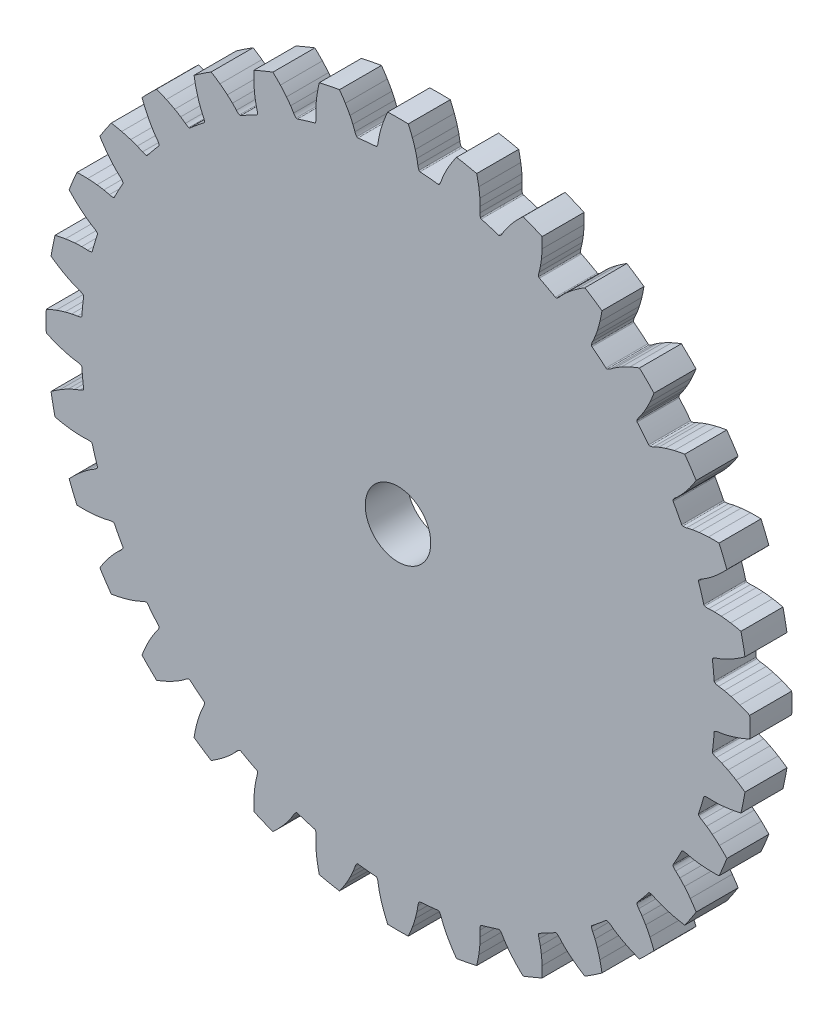
from build123d import *

# Parameters (mm, degrees)
BOSS_EXTRUDE1_DEPTH = 6.35
SKETCH2_R           = 4.953
CUT_EXTRUDE1_DEPTH  = 76.509747374


with BuildPart() as part:
    # Model → Boss-Extrude1 (new body)
    with BuildSketch(Plane.XY):
        with BuildLine():
            ThreePointArc((47.688684308, -4.696925442), (47.750668499, -4.0181311), (47.802991315, -3.338523772))
            ThreePointArc((47.802991315, -3.338523772), (47.836540789, -3.240219855), (47.914385854, -3.171449418))
            ThreePointArc((47.914385854, -3.171449418), (48.187811806, -3.062492558), (48.475756522, -3.001491007))
            ThreePointArc((48.475756522, -3.001491007), (48.904401032, -2.939153054), (49.330070734, -2.858981734))
            ThreePointArc((49.330070734, -2.858981734), (49.842301009, -2.742156063), (50.350208962, -2.60777748))
            ThreePointArc((50.350208962, -2.60777748), (51.029288231, -2.400648092), (51.699447533, -2.166260071))
            ThreePointArc((51.699447533, -2.166260071), (52.446034926, -1.872790357), (53.181655372, -1.552821976))
            ThreePointArc((53.181655372, -1.552821976), (53.204320541, 0), (53.181655372, 1.552821976))
            ThreePointArc((53.181655372, 1.552821976), (52.446034933, 1.872790354), (51.699447549, 2.166260065))
            ThreePointArc((51.699447549, 2.166260065), (51.029288253, 2.400648085), (50.350208991, 2.607777472))
            ThreePointArc((50.350208991, 2.607777472), (49.84230104, 2.742156056), (49.330070766, 2.858981727))
            ThreePointArc((49.330070766, 2.858981727), (48.904401064, 2.939153049), (48.475756554, 3.001491003))
            ThreePointArc((48.475756554, 3.001491003), (48.187811841, 3.062492546), (47.914385887, 3.171449391))
            ThreePointArc((47.914385887, 3.171449391), (47.836540814, 3.24021982), (47.802991318, 3.338523731))
            ThreePointArc((47.802991318, 3.338523731), (47.68868431, 4.696925421), (47.535783919, 6.051525995))
            ThreePointArc((47.535783919, 6.051525995), (47.549510606, 6.154486207), (47.612443453, 6.237122059))
            ThreePointArc((47.612443453, 6.237122059), (47.859359173, 6.397328101), (48.1298703, 6.513332751))
            ThreePointArc((48.1298703, 6.513332751), (48.538116994, 6.658097293), (48.939966924, 6.819772183))
            ThreePointArc((48.939966924, 6.819772183), (49.419563281, 7.034284251), (49.891495964, 7.265168713))
            ThreePointArc((49.891495964, 7.265168713), (50.517117975, 7.600799961), (51.12867352, 7.961425877))
            ThreePointArc((51.12867352, 7.961425877), (51.803662344, 8.394908626), (52.462725316, 8.852241335))
            ThreePointArc((52.462725316, 8.852241335), (52.182014441, 10.379648027), (51.856844238, 11.898211209))
            ThreePointArc((51.856844238, 11.898211209), (51.072935805, 12.068519056), (50.283440788, 12.210697855))
            ThreePointArc((50.283440788, 12.210697855), (49.58043158, 12.309840583), (48.873991697, 12.380508245))
            ThreePointArc((48.873991697, 12.380508245), (48.349627093, 12.413216856), (47.824447623, 12.427866586))
            ThreePointArc((47.824447623, 12.427866586), (47.391316396, 12.423453399), (46.958746639, 12.400969151))
            ThreePointArc((46.958746639, 12.400969151), (46.664433891, 12.404623339), (46.375005314, 12.458143852))
            ThreePointArc((46.375005314, 12.458143852), (46.285239567, 12.510406057), (46.233156574, 12.600275903))
            ThreePointArc((46.233156574, 12.600275903), (45.856034921, 13.910276095), (45.441803005, 15.209019012))
            ThreePointArc((45.441803005, 15.209019012), (45.435179397, 15.312678816), (45.480781552, 15.406004433))
            ThreePointArc((45.480781552, 15.406004433), (45.691698208, 15.611303028), (45.934380154, 15.777852784))
            ThreePointArc((45.934380154, 15.777852784), (46.306540342, 15.999480695), (46.669127631, 16.236446079))
            ThreePointArc((46.669127631, 16.236446079), (47.09765945, 16.540400966), (47.515480755, 16.858918547))
            ThreePointArc((47.515480755, 16.858918547), (48.063603207, 17.310153534), (48.593053257, 17.783158692))
            ThreePointArc((48.593053257, 17.783158692), (49.170504071, 18.339995979), (49.727682147, 18.917117976))
            ThreePointArc((49.727682147, 18.917117976), (49.154382789, 20.360412001), (48.53920366, 21.786358858))
            ThreePointArc((48.53920366, 21.786358858), (47.737132396, 21.800461339), (46.935069596, 21.785885375))
            ThreePointArc((46.935069596, 21.785885375), (46.226226726, 21.74597281), (45.51957431, 21.677463029))
            ThreePointArc((45.51957431, 21.677463029), (44.998904092, 21.607244694), (44.480957778, 21.519155501))
            ThreePointArc((44.480957778, 21.519155501), (44.057010016, 21.430327401), (43.637138424, 21.323885009))
            ThreePointArc((43.637138424, 21.323885009), (43.347767917, 21.270051415), (43.053459295, 21.266078831))
            ThreePointArc((43.053459295, 21.266078831), (42.955222521, 21.299824404), (42.886607551, 21.377806538))
            ThreePointArc((42.886607551, 21.377806538), (42.261163825, 22.589062659), (41.601519086, 23.782037958))
            ThreePointArc((41.601519086, 23.782037958), (41.574799724, 23.882413766), (41.601318722, 23.982842696))
            ThreePointArc((41.601318722, 23.982842696), (41.768130904, 24.225344334), (41.97365754, 24.436038783))
            ThreePointArc((41.97365754, 24.436038783), (42.295429313, 24.726013026), (42.604819936, 25.029162458))
            ThreePointArc((42.604819936, 25.029162458), (42.965818979, 25.410879347), (43.313472268, 25.804789596))
            ThreePointArc((43.313472268, 25.804789596), (43.763031121, 26.354287614), (44.190029209, 26.921494692))
            ThreePointArc((44.190029209, 26.921494692), (44.647750902, 27.580287572), (45.081632041, 28.255020382))
            ThreePointArc((45.081632041, 28.255020382), (44.237775773, 29.558736761), (43.356228707, 30.837268954))
            ThreePointArc((43.356228707, 30.837268954), (42.566817759, 30.694624119), (41.783010001, 30.523853538))
            ThreePointArc((41.783010001, 30.523853538), (41.095573903, 30.346419498), (40.415865211, 30.141365065))
            ThreePointArc((40.415865211, 30.141365065), (39.918898443, 29.970918235), (39.42808967, 29.783475339))
            ThreePointArc((39.42808967, 29.783475339), (39.029617448, 29.613645941), (38.638579452, 29.427335925))
            ThreePointArc((38.638579452, 29.427335925), (38.365271531, 29.318083343), (38.07739298, 29.256770328))
            ThreePointArc((38.07739298, 29.256770328), (37.974460363, 29.270702445), (37.891950251, 29.333800058))
            ThreePointArc((37.891950251, 29.333800058), (37.042219904, 30.399764214), (36.162512118, 31.441126522))
            ThreePointArc((36.162512118, 31.441126522), (36.116723813, 31.534360948), (36.123140543, 31.638033764))
            ThreePointArc((36.123140543, 31.638033764), (36.239437753, 31.908419244), (36.399910804, 32.155161515))
            ThreePointArc((36.399910804, 32.155161515), (36.658928655, 32.502338544), (36.903232904, 32.860022161))
            ThreePointArc((36.903232904, 32.860022161), (37.182826181, 33.304831886), (37.446951331, 33.758997052))
            ThreePointArc((37.446951331, 33.758997052), (37.780670292, 34.385641202), (38.08880712, 35.025252749))
            ThreePointArc((38.08880712, 35.025252749), (38.409209704, 35.760684181), (38.703120097, 36.5070982))
            ThreePointArc((38.703120097, 36.5070982), (37.621135843, 37.621135843), (36.5070982, 38.703120097))
            ThreePointArc((36.5070982, 38.703120097), (35.760684189, 38.409209707), (35.025252764, 38.088807127))
            ThreePointArc((35.025252764, 38.088807127), (34.385641222, 37.780670303), (33.758997077, 37.446951346))
            ThreePointArc((33.758997077, 37.446951346), (33.304831913, 37.182826197), (32.860022188, 36.903232922))
            ThreePointArc((32.860022188, 36.903232922), (32.50233857, 36.658928674), (32.155161541, 36.399910824))
            ThreePointArc((32.155161541, 36.399910824), (31.908419277, 36.239437769), (31.638033806, 36.123140547))
            ThreePointArc((31.638033806, 36.123140547), (31.53436099, 36.116723805), (31.441126553, 36.162512091))
            ThreePointArc((31.441126553, 36.162512091), (30.399764246, 37.042219878), (29.33380009, 37.891950226))
            ThreePointArc((29.33380009, 37.891950226), (29.27070246, 37.974460324), (29.256770332, 38.077392938))
            ThreePointArc((29.256770332, 38.077392938), (29.318083333, 38.365271496), (29.427335911, 38.638579423))
            ThreePointArc((29.427335911, 38.638579423), (29.613645927, 39.029617418), (29.783475326, 39.42808964))
            ThreePointArc((29.783475326, 39.42808964), (29.970918225, 39.918898413), (30.141365056, 40.415865183))
            ThreePointArc((30.141365056, 40.415865183), (30.346419492, 41.095573881), (30.523853534, 41.783009985))
            ThreePointArc((30.523853534, 41.783009985), (30.694624117, 42.566817751), (30.837268954, 43.356228707))
            ThreePointArc((30.837268954, 43.356228707), (29.558736761, 44.237775773), (28.255020382, 45.081632041))
            ThreePointArc((28.255020382, 45.081632041), (27.580287579, 44.647750906), (26.921494706, 44.190029219))
            ThreePointArc((26.921494706, 44.190029219), (26.354287633, 43.763031136), (25.804789618, 43.313472287))
            ThreePointArc((25.804789618, 43.313472287), (25.41087937, 42.965819), (25.029162482, 42.604819959))
            ThreePointArc((25.029162482, 42.604819959), (24.726013049, 42.295429337), (24.436038804, 41.973657564))
            ThreePointArc((24.436038804, 41.973657564), (24.225344363, 41.768130926), (23.982842736, 41.601318734))
            ThreePointArc((23.982842736, 41.601318734), (23.882413809, 41.574799725), (23.782037994, 41.601519065))
            ThreePointArc((23.782037994, 41.601519065), (22.589062696, 42.261163806), (21.377806575, 42.886607533))
            ThreePointArc((21.377806575, 42.886607533), (21.299824427, 42.955222485), (21.266078844, 43.053459254))
            ThreePointArc((21.266078844, 43.053459254), (21.270051412, 43.34776788), (21.323885001, 43.637138393))
            ThreePointArc((21.323885001, 43.637138393), (21.430327394, 44.057009984), (21.519155495, 44.480957745))
            ThreePointArc((21.519155495, 44.480957745), (21.607244689, 44.998904061), (21.677463025, 45.519574281))
            ThreePointArc((21.677463025, 45.519574281), (21.745972809, 46.226226703), (21.785885375, 46.935069579))
            ThreePointArc((21.785885375, 46.935069579), (21.800461339, 47.737132387), (21.786358858, 48.53920366))
            ThreePointArc((21.786358858, 48.53920366), (20.360412001, 49.154382789), (18.917117976, 49.727682147))
            ThreePointArc((18.917117976, 49.727682147), (18.339995985, 49.170504077), (17.783158704, 48.59305327))
            ThreePointArc((17.783158704, 48.59305327), (17.310153549, 48.063603224), (16.858918565, 47.515480778))
            ThreePointArc((16.858918565, 47.515480778), (16.540400984, 47.097659475), (16.236446098, 46.669127659))
            ThreePointArc((16.236446098, 46.669127659), (15.999480712, 46.30654037), (15.7778528, 45.934380183))
            ThreePointArc((15.7778528, 45.934380183), (15.611303052, 45.691698235), (15.40600447, 45.480781572))
            ThreePointArc((15.40600447, 45.480781572), (15.312678858, 45.435179406), (15.209019052, 45.441802992))
            ThreePointArc((15.209019052, 45.441802992), (13.910276134, 45.856034909), (12.600275943, 46.233156564))
            ThreePointArc((12.600275943, 46.233156564), (12.510406086, 46.285239536), (12.458143872, 46.375005277))
            ThreePointArc((12.458143872, 46.375005277), (12.404623344, 46.664433855), (12.400969149, 46.958746606))
            ThreePointArc((12.400969149, 46.958746606), (12.423453398, 47.391316363), (12.427866586, 47.82444759))
            ThreePointArc((12.427866586, 47.82444759), (12.413216857, 48.349627062), (12.380508247, 48.873991667))
            ThreePointArc((12.380508247, 48.873991667), (12.309840586, 49.580431557), (12.210697858, 50.283440771))
            ThreePointArc((12.210697858, 50.283440771), (12.068519058, 51.072935797), (11.898211209, 51.856844238))
            ThreePointArc((11.898211209, 51.856844238), (10.379648027, 52.182014441), (8.852241335, 52.462725316))
            ThreePointArc((8.852241335, 52.462725316), (8.394908631, 51.803662352), (7.961425885, 51.128673535))
            ThreePointArc((7.961425885, 51.128673535), (7.600799972, 50.517117996), (7.265168727, 49.89149599))
            ThreePointArc((7.265168727, 49.89149599), (7.034284264, 49.419563309), (6.819772196, 48.939966954))
            ThreePointArc((6.819772196, 48.939966954), (6.658097305, 48.538117025), (6.513332761, 48.129870331))
            ThreePointArc((6.513332761, 48.129870331), (6.397328119, 47.859359205), (6.237122092, 47.61244348))
            ThreePointArc((6.237122092, 47.61244348), (6.154486246, 47.549510624), (6.051526036, 47.535783914))
            ThreePointArc((6.051526036, 47.535783914), (4.696925462, 47.688684306), (3.338523772, 47.802991315))
            ThreePointArc((3.338523772, 47.802991315), (3.240219855, 47.836540789), (3.171449418, 47.914385854))
            ThreePointArc((3.171449418, 47.914385854), (3.062492558, 48.187811806), (3.001491007, 48.475756522))
            ThreePointArc((3.001491007, 48.475756522), (2.939153054, 48.904401032), (2.858981734, 49.330070734))
            ThreePointArc((2.858981734, 49.330070734), (2.742156063, 49.842301009), (2.60777748, 50.350208962))
            ThreePointArc((2.60777748, 50.350208962), (2.400648092, 51.029288231), (2.166260071, 51.699447533))
            ThreePointArc((2.166260071, 51.699447533), (1.872790357, 52.446034926), (1.552821976, 53.181655372))
            ThreePointArc((1.552821976, 53.181655372), (0, 53.204320541), (-1.552821976, 53.181655372))
            ThreePointArc((-1.552821976, 53.181655372), (-1.872790354, 52.446034933), (-2.166260065, 51.699447549))
            ThreePointArc((-2.166260065, 51.699447549), (-2.400648085, 51.029288253), (-2.607777472, 50.350208991))
            ThreePointArc((-2.607777472, 50.350208991), (-2.742156056, 49.84230104), (-2.858981727, 49.330070766))
            ThreePointArc((-2.858981727, 49.330070766), (-2.939153049, 48.904401064), (-3.001491003, 48.475756554))
            ThreePointArc((-3.001491003, 48.475756554), (-3.062492546, 48.187811841), (-3.171449391, 47.914385887))
            ThreePointArc((-3.171449391, 47.914385887), (-3.24021982, 47.836540814), (-3.338523731, 47.802991318))
            ThreePointArc((-3.338523731, 47.802991318), (-4.696925421, 47.68868431), (-6.051525995, 47.535783919))
            ThreePointArc((-6.051525995, 47.535783919), (-6.154486207, 47.549510606), (-6.237122059, 47.612443453))
            ThreePointArc((-6.237122059, 47.612443453), (-6.397328101, 47.859359173), (-6.513332751, 48.1298703))
            ThreePointArc((-6.513332751, 48.1298703), (-6.658097293, 48.538116994), (-6.819772183, 48.939966924))
            ThreePointArc((-6.819772183, 48.939966924), (-7.034284251, 49.419563281), (-7.265168713, 49.891495964))
            ThreePointArc((-7.265168713, 49.891495964), (-7.600799961, 50.517117975), (-7.961425877, 51.12867352))
            ThreePointArc((-7.961425877, 51.12867352), (-8.394908626, 51.803662344), (-8.852241335, 52.462725316))
            ThreePointArc((-8.852241335, 52.462725316), (-10.379648027, 52.182014441), (-11.898211209, 51.856844238))
            ThreePointArc((-11.898211209, 51.856844238), (-12.068519056, 51.072935805), (-12.210697855, 50.283440788))
            ThreePointArc((-12.210697855, 50.283440788), (-12.309840583, 49.58043158), (-12.380508245, 48.873991697))
            ThreePointArc((-12.380508245, 48.873991697), (-12.413216856, 48.349627093), (-12.427866586, 47.824447623))
            ThreePointArc((-12.427866586, 47.824447623), (-12.423453399, 47.391316396), (-12.400969151, 46.958746639))
            ThreePointArc((-12.400969151, 46.958746639), (-12.404623339, 46.664433891), (-12.458143852, 46.375005314))
            ThreePointArc((-12.458143852, 46.375005314), (-12.510406057, 46.285239567), (-12.600275903, 46.233156574))
            ThreePointArc((-12.600275903, 46.233156574), (-13.910276095, 45.856034921), (-15.209019012, 45.441803005))
            ThreePointArc((-15.209019012, 45.441803005), (-15.312678816, 45.435179397), (-15.406004433, 45.480781552))
            ThreePointArc((-15.406004433, 45.480781552), (-15.611303028, 45.691698208), (-15.777852784, 45.934380154))
            ThreePointArc((-15.777852784, 45.934380154), (-15.999480695, 46.306540342), (-16.236446079, 46.669127631))
            ThreePointArc((-16.236446079, 46.669127631), (-16.540400966, 47.09765945), (-16.858918547, 47.515480755))
            ThreePointArc((-16.858918547, 47.515480755), (-17.310153534, 48.063603207), (-17.783158692, 48.593053257))
            ThreePointArc((-17.783158692, 48.593053257), (-18.339995979, 49.170504071), (-18.917117976, 49.727682147))
            ThreePointArc((-18.917117976, 49.727682147), (-20.360412001, 49.154382789), (-21.786358858, 48.53920366))
            ThreePointArc((-21.786358858, 48.53920366), (-21.800461339, 47.737132396), (-21.785885375, 46.935069596))
            ThreePointArc((-21.785885375, 46.935069596), (-21.74597281, 46.226226726), (-21.677463029, 45.51957431))
            ThreePointArc((-21.677463029, 45.51957431), (-21.607244694, 44.998904092), (-21.519155501, 44.480957778))
            ThreePointArc((-21.519155501, 44.480957778), (-21.430327401, 44.057010016), (-21.323885009, 43.637138424))
            ThreePointArc((-21.323885009, 43.637138424), (-21.270051415, 43.347767917), (-21.266078831, 43.053459295))
            ThreePointArc((-21.266078831, 43.053459295), (-21.299824404, 42.955222521), (-21.377806538, 42.886607551))
            ThreePointArc((-21.377806538, 42.886607551), (-22.589062659, 42.261163825), (-23.782037958, 41.601519086))
            ThreePointArc((-23.782037958, 41.601519086), (-23.882413766, 41.574799724), (-23.982842696, 41.601318722))
            ThreePointArc((-23.982842696, 41.601318722), (-24.225344334, 41.768130904), (-24.436038783, 41.97365754))
            ThreePointArc((-24.436038783, 41.97365754), (-24.726013026, 42.295429313), (-25.029162458, 42.604819936))
            ThreePointArc((-25.029162458, 42.604819936), (-25.410879347, 42.965818979), (-25.804789596, 43.313472268))
            ThreePointArc((-25.804789596, 43.313472268), (-26.354287614, 43.763031121), (-26.921494692, 44.190029209))
            ThreePointArc((-26.921494692, 44.190029209), (-27.580287572, 44.647750902), (-28.255020382, 45.081632041))
            ThreePointArc((-28.255020382, 45.081632041), (-29.558736761, 44.237775773), (-30.837268954, 43.356228707))
            ThreePointArc((-30.837268954, 43.356228707), (-30.694624119, 42.566817759), (-30.523853538, 41.783010001))
            ThreePointArc((-30.523853538, 41.783010001), (-30.346419498, 41.095573903), (-30.141365065, 40.415865211))
            ThreePointArc((-30.141365065, 40.415865211), (-29.970918235, 39.918898443), (-29.783475339, 39.42808967))
            ThreePointArc((-29.783475339, 39.42808967), (-29.613645941, 39.029617448), (-29.427335925, 38.638579452))
            ThreePointArc((-29.427335925, 38.638579452), (-29.318083343, 38.365271531), (-29.256770328, 38.07739298))
            ThreePointArc((-29.256770328, 38.07739298), (-29.270702445, 37.974460363), (-29.333800058, 37.891950251))
            ThreePointArc((-29.333800058, 37.891950251), (-30.399764214, 37.042219904), (-31.441126522, 36.162512118))
            ThreePointArc((-31.441126522, 36.162512118), (-31.534360948, 36.116723813), (-31.638033764, 36.123140543))
            ThreePointArc((-31.638033764, 36.123140543), (-31.908419244, 36.239437753), (-32.155161515, 36.399910804))
            ThreePointArc((-32.155161515, 36.399910804), (-32.502338544, 36.658928655), (-32.860022161, 36.903232904))
            ThreePointArc((-32.860022161, 36.903232904), (-33.304831886, 37.182826181), (-33.758997052, 37.446951331))
            ThreePointArc((-33.758997052, 37.446951331), (-34.385641202, 37.780670292), (-35.025252749, 38.08880712))
            ThreePointArc((-35.025252749, 38.08880712), (-35.760684181, 38.409209704), (-36.5070982, 38.703120097))
            ThreePointArc((-36.5070982, 38.703120097), (-37.621135843, 37.621135843), (-38.703120097, 36.5070982))
            ThreePointArc((-38.703120097, 36.5070982), (-38.409209707, 35.760684189), (-38.088807127, 35.025252764))
            ThreePointArc((-38.088807127, 35.025252764), (-37.780670303, 34.385641222), (-37.446951346, 33.758997077))
            ThreePointArc((-37.446951346, 33.758997077), (-37.182826197, 33.304831913), (-36.903232922, 32.860022188))
            ThreePointArc((-36.903232922, 32.860022188), (-36.658928674, 32.50233857), (-36.399910824, 32.155161541))
            ThreePointArc((-36.399910824, 32.155161541), (-36.239437769, 31.908419277), (-36.123140547, 31.638033806))
            ThreePointArc((-36.123140547, 31.638033806), (-36.116723805, 31.53436099), (-36.162512091, 31.441126553))
            ThreePointArc((-36.162512091, 31.441126553), (-37.042219878, 30.399764246), (-37.891950226, 29.33380009))
            ThreePointArc((-37.891950226, 29.33380009), (-37.974460324, 29.27070246), (-38.077392938, 29.256770332))
            ThreePointArc((-38.077392938, 29.256770332), (-38.365271496, 29.318083333), (-38.638579423, 29.427335911))
            ThreePointArc((-38.638579423, 29.427335911), (-39.029617418, 29.613645927), (-39.42808964, 29.783475326))
            ThreePointArc((-39.42808964, 29.783475326), (-39.918898413, 29.970918225), (-40.415865183, 30.141365056))
            ThreePointArc((-40.415865183, 30.141365056), (-41.095573881, 30.346419492), (-41.783009985, 30.523853534))
            ThreePointArc((-41.783009985, 30.523853534), (-42.566817751, 30.694624117), (-43.356228707, 30.837268954))
            ThreePointArc((-43.356228707, 30.837268954), (-44.237775773, 29.558736761), (-45.081632041, 28.255020382))
            ThreePointArc((-45.081632041, 28.255020382), (-44.647750906, 27.580287579), (-44.190029219, 26.921494706))
            ThreePointArc((-44.190029219, 26.921494706), (-43.763031136, 26.354287633), (-43.313472287, 25.804789618))
            ThreePointArc((-43.313472287, 25.804789618), (-42.965819, 25.41087937), (-42.604819959, 25.029162482))
            ThreePointArc((-42.604819959, 25.029162482), (-42.295429337, 24.726013049), (-41.973657564, 24.436038804))
            ThreePointArc((-41.973657564, 24.436038804), (-41.768130926, 24.225344363), (-41.601318734, 23.982842736))
            ThreePointArc((-41.601318734, 23.982842736), (-41.574799725, 23.882413809), (-41.601519065, 23.782037994))
            ThreePointArc((-41.601519065, 23.782037994), (-42.261163806, 22.589062696), (-42.886607533, 21.377806575))
            ThreePointArc((-42.886607533, 21.377806575), (-42.955222485, 21.299824427), (-43.053459254, 21.266078844))
            ThreePointArc((-43.053459254, 21.266078844), (-43.34776788, 21.270051412), (-43.637138393, 21.323885001))
            ThreePointArc((-43.637138393, 21.323885001), (-44.057009984, 21.430327394), (-44.480957745, 21.519155495))
            ThreePointArc((-44.480957745, 21.519155495), (-44.998904061, 21.607244689), (-45.519574281, 21.677463025))
            ThreePointArc((-45.519574281, 21.677463025), (-46.226226703, 21.745972809), (-46.935069579, 21.785885375))
            ThreePointArc((-46.935069579, 21.785885375), (-47.737132387, 21.800461339), (-48.53920366, 21.786358858))
            ThreePointArc((-48.53920366, 21.786358858), (-49.154382789, 20.360412001), (-49.727682147, 18.917117976))
            ThreePointArc((-49.727682147, 18.917117976), (-49.170504077, 18.339995985), (-48.59305327, 17.783158704))
            ThreePointArc((-48.59305327, 17.783158704), (-48.063603224, 17.310153549), (-47.515480778, 16.858918565))
            ThreePointArc((-47.515480778, 16.858918565), (-47.097659475, 16.540400984), (-46.669127659, 16.236446098))
            ThreePointArc((-46.669127659, 16.236446098), (-46.30654037, 15.999480712), (-45.934380183, 15.7778528))
            ThreePointArc((-45.934380183, 15.7778528), (-45.691698235, 15.611303052), (-45.480781572, 15.40600447))
            ThreePointArc((-45.480781572, 15.40600447), (-45.435179406, 15.312678858), (-45.441802992, 15.209019052))
            ThreePointArc((-45.441802992, 15.209019052), (-45.856034909, 13.910276134), (-46.233156564, 12.600275943))
            ThreePointArc((-46.233156564, 12.600275943), (-46.285239536, 12.510406086), (-46.375005277, 12.458143872))
            ThreePointArc((-46.375005277, 12.458143872), (-46.664433855, 12.404623344), (-46.958746606, 12.400969149))
            ThreePointArc((-46.958746606, 12.400969149), (-47.391316363, 12.423453398), (-47.82444759, 12.427866586))
            ThreePointArc((-47.82444759, 12.427866586), (-48.349627062, 12.413216857), (-48.873991667, 12.380508247))
            ThreePointArc((-48.873991667, 12.380508247), (-49.580431557, 12.309840586), (-50.283440771, 12.210697858))
            ThreePointArc((-50.283440771, 12.210697858), (-51.072935797, 12.068519058), (-51.856844238, 11.898211209))
            ThreePointArc((-51.856844238, 11.898211209), (-52.182014441, 10.379648027), (-52.462725316, 8.852241335))
            ThreePointArc((-52.462725316, 8.852241335), (-51.803662352, 8.394908631), (-51.128673535, 7.961425885))
            ThreePointArc((-51.128673535, 7.961425885), (-50.517117996, 7.600799972), (-49.89149599, 7.265168727))
            ThreePointArc((-49.89149599, 7.265168727), (-49.419563309, 7.034284264), (-48.939966954, 6.819772196))
            ThreePointArc((-48.939966954, 6.819772196), (-48.538117025, 6.658097305), (-48.129870331, 6.513332761))
            ThreePointArc((-48.129870331, 6.513332761), (-47.859359205, 6.397328119), (-47.61244348, 6.237122092))
            ThreePointArc((-47.61244348, 6.237122092), (-47.549510624, 6.154486246), (-47.535783914, 6.051526036))
            ThreePointArc((-47.535783914, 6.051526036), (-47.688684306, 4.696925462), (-47.802991315, 3.338523772))
            ThreePointArc((-47.802991315, 3.338523772), (-47.836540789, 3.240219855), (-47.914385854, 3.171449418))
            ThreePointArc((-47.914385854, 3.171449418), (-48.187811806, 3.062492558), (-48.475756522, 3.001491007))
            ThreePointArc((-48.475756522, 3.001491007), (-48.904401032, 2.939153054), (-49.330070734, 2.858981734))
            ThreePointArc((-49.330070734, 2.858981734), (-49.842301009, 2.742156063), (-50.350208962, 2.60777748))
            ThreePointArc((-50.350208962, 2.60777748), (-51.029288231, 2.400648092), (-51.699447533, 2.166260071))
            ThreePointArc((-51.699447533, 2.166260071), (-52.446034926, 1.872790357), (-53.181655372, 1.552821976))
            ThreePointArc((-53.181655372, 1.552821976), (-53.204320541, 0), (-53.181655372, -1.552821976))
            ThreePointArc((-53.181655372, -1.552821976), (-52.446034933, -1.872790354), (-51.699447549, -2.166260065))
            ThreePointArc((-51.699447549, -2.166260065), (-51.029288253, -2.400648085), (-50.350208991, -2.607777472))
            ThreePointArc((-50.350208991, -2.607777472), (-49.84230104, -2.742156056), (-49.330070766, -2.858981727))
            ThreePointArc((-49.330070766, -2.858981727), (-48.904401064, -2.939153049), (-48.475756554, -3.001491003))
            ThreePointArc((-48.475756554, -3.001491003), (-48.187811841, -3.062492546), (-47.914385887, -3.171449391))
            ThreePointArc((-47.914385887, -3.171449391), (-47.836540814, -3.24021982), (-47.802991318, -3.338523731))
            ThreePointArc((-47.802991318, -3.338523731), (-47.68868431, -4.696925421), (-47.535783919, -6.051525995))
            ThreePointArc((-47.535783919, -6.051525995), (-47.549510606, -6.154486207), (-47.612443453, -6.237122059))
            ThreePointArc((-47.612443453, -6.237122059), (-47.859359173, -6.397328101), (-48.1298703, -6.513332751))
            ThreePointArc((-48.1298703, -6.513332751), (-48.538116994, -6.658097293), (-48.939966924, -6.819772183))
            ThreePointArc((-48.939966924, -6.819772183), (-49.419563281, -7.034284251), (-49.891495964, -7.265168713))
            ThreePointArc((-49.891495964, -7.265168713), (-50.517117975, -7.600799961), (-51.12867352, -7.961425877))
            ThreePointArc((-51.12867352, -7.961425877), (-51.803662344, -8.394908626), (-52.462725316, -8.852241335))
            ThreePointArc((-52.462725316, -8.852241335), (-52.182014441, -10.379648027), (-51.856844238, -11.898211209))
            ThreePointArc((-51.856844238, -11.898211209), (-51.072935805, -12.068519056), (-50.283440788, -12.210697855))
            ThreePointArc((-50.283440788, -12.210697855), (-49.58043158, -12.309840583), (-48.873991697, -12.380508245))
            ThreePointArc((-48.873991697, -12.380508245), (-48.349627093, -12.413216856), (-47.824447623, -12.427866586))
            ThreePointArc((-47.824447623, -12.427866586), (-47.391316396, -12.423453399), (-46.958746639, -12.400969151))
            ThreePointArc((-46.958746639, -12.400969151), (-46.664433891, -12.404623339), (-46.375005314, -12.458143852))
            ThreePointArc((-46.375005314, -12.458143852), (-46.285239567, -12.510406057), (-46.233156574, -12.600275903))
            ThreePointArc((-46.233156574, -12.600275903), (-45.856034921, -13.910276095), (-45.441803005, -15.209019012))
            ThreePointArc((-45.441803005, -15.209019012), (-45.435179397, -15.312678816), (-45.480781552, -15.406004433))
            ThreePointArc((-45.480781552, -15.406004433), (-45.691698208, -15.611303028), (-45.934380154, -15.777852784))
            ThreePointArc((-45.934380154, -15.777852784), (-46.306540342, -15.999480695), (-46.669127631, -16.236446079))
            ThreePointArc((-46.669127631, -16.236446079), (-47.09765945, -16.540400966), (-47.515480755, -16.858918547))
            ThreePointArc((-47.515480755, -16.858918547), (-48.063603207, -17.310153534), (-48.593053257, -17.783158692))
            ThreePointArc((-48.593053257, -17.783158692), (-49.170504071, -18.339995979), (-49.727682147, -18.917117976))
            ThreePointArc((-49.727682147, -18.917117976), (-49.154382789, -20.360412001), (-48.53920366, -21.786358858))
            ThreePointArc((-48.53920366, -21.786358858), (-47.737132396, -21.800461339), (-46.935069596, -21.785885375))
            ThreePointArc((-46.935069596, -21.785885375), (-46.226226726, -21.74597281), (-45.51957431, -21.677463029))
            ThreePointArc((-45.51957431, -21.677463029), (-44.998904092, -21.607244694), (-44.480957778, -21.519155501))
            ThreePointArc((-44.480957778, -21.519155501), (-44.057010016, -21.430327401), (-43.637138424, -21.323885009))
            ThreePointArc((-43.637138424, -21.323885009), (-43.347767917, -21.270051415), (-43.053459295, -21.266078831))
            ThreePointArc((-43.053459295, -21.266078831), (-42.955222521, -21.299824404), (-42.886607551, -21.377806538))
            ThreePointArc((-42.886607551, -21.377806538), (-42.261163825, -22.589062659), (-41.601519086, -23.782037958))
            ThreePointArc((-41.601519086, -23.782037958), (-41.574799724, -23.882413766), (-41.601318722, -23.982842696))
            ThreePointArc((-41.601318722, -23.982842696), (-41.768130904, -24.225344334), (-41.97365754, -24.436038783))
            ThreePointArc((-41.97365754, -24.436038783), (-42.295429313, -24.726013026), (-42.604819936, -25.029162458))
            ThreePointArc((-42.604819936, -25.029162458), (-42.965818979, -25.410879347), (-43.313472268, -25.804789596))
            ThreePointArc((-43.313472268, -25.804789596), (-43.763031121, -26.354287614), (-44.190029209, -26.921494692))
            ThreePointArc((-44.190029209, -26.921494692), (-44.647750902, -27.580287572), (-45.081632041, -28.255020382))
            ThreePointArc((-45.081632041, -28.255020382), (-44.237775773, -29.558736761), (-43.356228707, -30.837268954))
            ThreePointArc((-43.356228707, -30.837268954), (-42.566817759, -30.694624119), (-41.783010001, -30.523853538))
            ThreePointArc((-41.783010001, -30.523853538), (-41.095573903, -30.346419498), (-40.415865211, -30.141365065))
            ThreePointArc((-40.415865211, -30.141365065), (-39.918898443, -29.970918235), (-39.42808967, -29.783475339))
            ThreePointArc((-39.42808967, -29.783475339), (-39.029617448, -29.613645941), (-38.638579452, -29.427335925))
            ThreePointArc((-38.638579452, -29.427335925), (-38.365271531, -29.318083343), (-38.07739298, -29.256770328))
            ThreePointArc((-38.07739298, -29.256770328), (-37.974460363, -29.270702445), (-37.891950251, -29.333800058))
            ThreePointArc((-37.891950251, -29.333800058), (-37.042219904, -30.399764214), (-36.162512118, -31.441126522))
            ThreePointArc((-36.162512118, -31.441126522), (-36.116723813, -31.534360948), (-36.123140543, -31.638033764))
            ThreePointArc((-36.123140543, -31.638033764), (-36.239437753, -31.908419244), (-36.399910804, -32.155161515))
            ThreePointArc((-36.399910804, -32.155161515), (-36.658928655, -32.502338544), (-36.903232904, -32.860022161))
            ThreePointArc((-36.903232904, -32.860022161), (-37.182826181, -33.304831886), (-37.446951331, -33.758997052))
            ThreePointArc((-37.446951331, -33.758997052), (-37.780670292, -34.385641202), (-38.08880712, -35.025252749))
            ThreePointArc((-38.08880712, -35.025252749), (-38.409209704, -35.760684181), (-38.703120097, -36.5070982))
            ThreePointArc((-38.703120097, -36.5070982), (-37.621135843, -37.621135843), (-36.5070982, -38.703120097))
            ThreePointArc((-36.5070982, -38.703120097), (-35.760684189, -38.409209707), (-35.025252764, -38.088807127))
            ThreePointArc((-35.025252764, -38.088807127), (-34.385641222, -37.780670303), (-33.758997077, -37.446951346))
            ThreePointArc((-33.758997077, -37.446951346), (-33.304831913, -37.182826197), (-32.860022188, -36.903232922))
            ThreePointArc((-32.860022188, -36.903232922), (-32.50233857, -36.658928674), (-32.155161541, -36.399910824))
            ThreePointArc((-32.155161541, -36.399910824), (-31.908419277, -36.239437769), (-31.638033806, -36.123140547))
            ThreePointArc((-31.638033806, -36.123140547), (-31.53436099, -36.116723805), (-31.441126553, -36.162512091))
            ThreePointArc((-31.441126553, -36.162512091), (-30.399764246, -37.042219878), (-29.33380009, -37.891950226))
            ThreePointArc((-29.33380009, -37.891950226), (-29.27070246, -37.974460324), (-29.256770332, -38.077392938))
            ThreePointArc((-29.256770332, -38.077392938), (-29.318083333, -38.365271496), (-29.427335911, -38.638579423))
            ThreePointArc((-29.427335911, -38.638579423), (-29.613645927, -39.029617418), (-29.783475326, -39.42808964))
            ThreePointArc((-29.783475326, -39.42808964), (-29.970918225, -39.918898413), (-30.141365056, -40.415865183))
            ThreePointArc((-30.141365056, -40.415865183), (-30.346419492, -41.095573881), (-30.523853534, -41.783009985))
            ThreePointArc((-30.523853534, -41.783009985), (-30.694624117, -42.566817751), (-30.837268954, -43.356228707))
            ThreePointArc((-30.837268954, -43.356228707), (-29.558736761, -44.237775773), (-28.255020382, -45.081632041))
            ThreePointArc((-28.255020382, -45.081632041), (-27.580287579, -44.647750906), (-26.921494706, -44.190029219))
            ThreePointArc((-26.921494706, -44.190029219), (-26.354287633, -43.763031136), (-25.804789618, -43.313472287))
            ThreePointArc((-25.804789618, -43.313472287), (-25.41087937, -42.965819), (-25.029162482, -42.604819959))
            ThreePointArc((-25.029162482, -42.604819959), (-24.726013049, -42.295429337), (-24.436038804, -41.973657564))
            ThreePointArc((-24.436038804, -41.973657564), (-24.225344363, -41.768130926), (-23.982842736, -41.601318734))
            ThreePointArc((-23.982842736, -41.601318734), (-23.882413809, -41.574799725), (-23.782037994, -41.601519065))
            ThreePointArc((-23.782037994, -41.601519065), (-22.589062696, -42.261163806), (-21.377806575, -42.886607533))
            ThreePointArc((-21.377806575, -42.886607533), (-21.299824427, -42.955222485), (-21.266078844, -43.053459254))
            ThreePointArc((-21.266078844, -43.053459254), (-21.270051412, -43.34776788), (-21.323885001, -43.637138393))
            ThreePointArc((-21.323885001, -43.637138393), (-21.430327394, -44.057009984), (-21.519155495, -44.480957745))
            ThreePointArc((-21.519155495, -44.480957745), (-21.607244689, -44.998904061), (-21.677463025, -45.519574281))
            ThreePointArc((-21.677463025, -45.519574281), (-21.745972809, -46.226226703), (-21.785885375, -46.935069579))
            ThreePointArc((-21.785885375, -46.935069579), (-21.800461339, -47.737132387), (-21.786358858, -48.53920366))
            ThreePointArc((-21.786358858, -48.53920366), (-20.360412001, -49.154382789), (-18.917117976, -49.727682147))
            ThreePointArc((-18.917117976, -49.727682147), (-18.339995985, -49.170504077), (-17.783158704, -48.59305327))
            ThreePointArc((-17.783158704, -48.59305327), (-17.310153549, -48.063603224), (-16.858918565, -47.515480778))
            ThreePointArc((-16.858918565, -47.515480778), (-16.540400984, -47.097659475), (-16.236446098, -46.669127659))
            ThreePointArc((-16.236446098, -46.669127659), (-15.999480712, -46.30654037), (-15.7778528, -45.934380183))
            ThreePointArc((-15.7778528, -45.934380183), (-15.611303052, -45.691698235), (-15.40600447, -45.480781572))
            ThreePointArc((-15.40600447, -45.480781572), (-15.312678858, -45.435179406), (-15.209019052, -45.441802992))
            ThreePointArc((-15.209019052, -45.441802992), (-13.910276134, -45.856034909), (-12.600275943, -46.233156564))
            ThreePointArc((-12.600275943, -46.233156564), (-12.510406086, -46.285239536), (-12.458143872, -46.375005277))
            ThreePointArc((-12.458143872, -46.375005277), (-12.404623344, -46.664433855), (-12.400969149, -46.958746606))
            ThreePointArc((-12.400969149, -46.958746606), (-12.423453398, -47.391316363), (-12.427866586, -47.82444759))
            ThreePointArc((-12.427866586, -47.82444759), (-12.413216857, -48.349627062), (-12.380508247, -48.873991667))
            ThreePointArc((-12.380508247, -48.873991667), (-12.309840586, -49.580431557), (-12.210697858, -50.283440771))
            ThreePointArc((-12.210697858, -50.283440771), (-12.068519058, -51.072935797), (-11.898211209, -51.856844238))
            ThreePointArc((-11.898211209, -51.856844238), (-10.379648027, -52.182014441), (-8.852241335, -52.462725316))
            ThreePointArc((-8.852241335, -52.462725316), (-8.394908631, -51.803662352), (-7.961425885, -51.128673535))
            ThreePointArc((-7.961425885, -51.128673535), (-7.600799972, -50.517117996), (-7.265168727, -49.89149599))
            ThreePointArc((-7.265168727, -49.89149599), (-7.034284264, -49.419563309), (-6.819772196, -48.939966954))
            ThreePointArc((-6.819772196, -48.939966954), (-6.658097305, -48.538117025), (-6.513332761, -48.129870331))
            ThreePointArc((-6.513332761, -48.129870331), (-6.397328119, -47.859359205), (-6.237122092, -47.61244348))
            ThreePointArc((-6.237122092, -47.61244348), (-6.154486246, -47.549510624), (-6.051526036, -47.535783914))
            ThreePointArc((-6.051526036, -47.535783914), (-4.696925462, -47.688684306), (-3.338523772, -47.802991315))
            ThreePointArc((-3.338523772, -47.802991315), (-3.240219855, -47.836540789), (-3.171449418, -47.914385854))
            ThreePointArc((-3.171449418, -47.914385854), (-3.062492558, -48.187811806), (-3.001491007, -48.475756522))
            ThreePointArc((-3.001491007, -48.475756522), (-2.939153054, -48.904401032), (-2.858981734, -49.330070734))
            ThreePointArc((-2.858981734, -49.330070734), (-2.742156063, -49.842301009), (-2.60777748, -50.350208962))
            ThreePointArc((-2.60777748, -50.350208962), (-2.400648092, -51.029288231), (-2.166260071, -51.699447533))
            ThreePointArc((-2.166260071, -51.699447533), (-1.872790357, -52.446034926), (-1.552821976, -53.181655372))
            ThreePointArc((-1.552821976, -53.181655372), (0, -53.204320541), (1.552821976, -53.181655372))
            ThreePointArc((1.552821976, -53.181655372), (1.872790354, -52.446034933), (2.166260065, -51.699447549))
            ThreePointArc((2.166260065, -51.699447549), (2.400648085, -51.029288253), (2.607777472, -50.350208991))
            ThreePointArc((2.607777472, -50.350208991), (2.742156056, -49.84230104), (2.858981727, -49.330070766))
            ThreePointArc((2.858981727, -49.330070766), (2.939153049, -48.904401064), (3.001491003, -48.475756554))
            ThreePointArc((3.001491003, -48.475756554), (3.062492546, -48.187811841), (3.171449391, -47.914385887))
            ThreePointArc((3.171449391, -47.914385887), (3.24021982, -47.836540814), (3.338523731, -47.802991318))
            ThreePointArc((3.338523731, -47.802991318), (4.696925421, -47.68868431), (6.051525995, -47.535783919))
            ThreePointArc((6.051525995, -47.535783919), (6.154486207, -47.549510606), (6.237122059, -47.612443453))
            ThreePointArc((6.237122059, -47.612443453), (6.397328101, -47.859359173), (6.513332751, -48.1298703))
            ThreePointArc((6.513332751, -48.1298703), (6.658097293, -48.538116994), (6.819772183, -48.939966924))
            ThreePointArc((6.819772183, -48.939966924), (7.034284251, -49.419563281), (7.265168713, -49.891495964))
            ThreePointArc((7.265168713, -49.891495964), (7.600799961, -50.517117975), (7.961425877, -51.12867352))
            ThreePointArc((7.961425877, -51.12867352), (8.394908626, -51.803662344), (8.852241335, -52.462725316))
            ThreePointArc((8.852241335, -52.462725316), (10.379648027, -52.182014441), (11.898211209, -51.856844238))
            ThreePointArc((11.898211209, -51.856844238), (12.068519056, -51.072935805), (12.210697855, -50.283440788))
            ThreePointArc((12.210697855, -50.283440788), (12.309840583, -49.58043158), (12.380508245, -48.873991697))
            ThreePointArc((12.380508245, -48.873991697), (12.413216856, -48.349627093), (12.427866586, -47.824447623))
            ThreePointArc((12.427866586, -47.824447623), (12.423453399, -47.391316396), (12.400969151, -46.958746639))
            ThreePointArc((12.400969151, -46.958746639), (12.404623339, -46.664433891), (12.458143852, -46.375005314))
            ThreePointArc((12.458143852, -46.375005314), (12.510406057, -46.285239567), (12.600275903, -46.233156574))
            ThreePointArc((12.600275903, -46.233156574), (13.910276095, -45.856034921), (15.209019012, -45.441803005))
            ThreePointArc((15.209019012, -45.441803005), (15.312678816, -45.435179397), (15.406004433, -45.480781552))
            ThreePointArc((15.406004433, -45.480781552), (15.611303028, -45.691698208), (15.777852784, -45.934380154))
            ThreePointArc((15.777852784, -45.934380154), (15.999480695, -46.306540342), (16.236446079, -46.669127631))
            ThreePointArc((16.236446079, -46.669127631), (16.540400966, -47.09765945), (16.858918547, -47.515480755))
            ThreePointArc((16.858918547, -47.515480755), (17.310153534, -48.063603207), (17.783158692, -48.593053257))
            ThreePointArc((17.783158692, -48.593053257), (18.339995979, -49.170504071), (18.917117976, -49.727682147))
            ThreePointArc((18.917117976, -49.727682147), (20.360412001, -49.154382789), (21.786358858, -48.53920366))
            ThreePointArc((21.786358858, -48.53920366), (21.800461339, -47.737132396), (21.785885375, -46.935069596))
            ThreePointArc((21.785885375, -46.935069596), (21.74597281, -46.226226726), (21.677463029, -45.51957431))
            ThreePointArc((21.677463029, -45.51957431), (21.607244694, -44.998904092), (21.519155501, -44.480957778))
            ThreePointArc((21.519155501, -44.480957778), (21.430327401, -44.057010016), (21.323885009, -43.637138424))
            ThreePointArc((21.323885009, -43.637138424), (21.270051415, -43.347767917), (21.266078831, -43.053459295))
            ThreePointArc((21.266078831, -43.053459295), (21.299824404, -42.955222521), (21.377806538, -42.886607551))
            ThreePointArc((21.377806538, -42.886607551), (22.589062659, -42.261163825), (23.782037958, -41.601519086))
            ThreePointArc((23.782037958, -41.601519086), (23.882413766, -41.574799724), (23.982842696, -41.601318722))
            ThreePointArc((23.982842696, -41.601318722), (24.225344334, -41.768130904), (24.436038783, -41.97365754))
            ThreePointArc((24.436038783, -41.97365754), (24.726013026, -42.295429313), (25.029162458, -42.604819936))
            ThreePointArc((25.029162458, -42.604819936), (25.410879347, -42.965818979), (25.804789596, -43.313472268))
            ThreePointArc((25.804789596, -43.313472268), (26.354287614, -43.763031121), (26.921494692, -44.190029209))
            ThreePointArc((26.921494692, -44.190029209), (27.580287572, -44.647750902), (28.255020382, -45.081632041))
            ThreePointArc((28.255020382, -45.081632041), (29.558736761, -44.237775773), (30.837268954, -43.356228707))
            ThreePointArc((30.837268954, -43.356228707), (30.694624119, -42.566817759), (30.523853538, -41.783010001))
            ThreePointArc((30.523853538, -41.783010001), (30.346419498, -41.095573903), (30.141365065, -40.415865211))
            ThreePointArc((30.141365065, -40.415865211), (29.970918235, -39.918898443), (29.783475339, -39.42808967))
            ThreePointArc((29.783475339, -39.42808967), (29.613645941, -39.029617448), (29.427335925, -38.638579452))
            ThreePointArc((29.427335925, -38.638579452), (29.318083343, -38.365271531), (29.256770328, -38.07739298))
            ThreePointArc((29.256770328, -38.07739298), (29.270702445, -37.974460363), (29.333800058, -37.891950251))
            ThreePointArc((29.333800058, -37.891950251), (30.399764214, -37.042219904), (31.441126522, -36.162512118))
            ThreePointArc((31.441126522, -36.162512118), (31.534360948, -36.116723813), (31.638033764, -36.123140543))
            ThreePointArc((31.638033764, -36.123140543), (31.908419244, -36.239437753), (32.155161515, -36.399910804))
            ThreePointArc((32.155161515, -36.399910804), (32.502338544, -36.658928655), (32.860022161, -36.903232904))
            ThreePointArc((32.860022161, -36.903232904), (33.304831886, -37.182826181), (33.758997052, -37.446951331))
            ThreePointArc((33.758997052, -37.446951331), (34.385641202, -37.780670292), (35.025252749, -38.08880712))
            ThreePointArc((35.025252749, -38.08880712), (35.760684181, -38.409209704), (36.5070982, -38.703120097))
            ThreePointArc((36.5070982, -38.703120097), (37.621135843, -37.621135843), (38.703120097, -36.5070982))
            ThreePointArc((38.703120097, -36.5070982), (38.409209707, -35.760684189), (38.088807127, -35.025252764))
            ThreePointArc((38.088807127, -35.025252764), (37.780670303, -34.385641222), (37.446951346, -33.758997077))
            ThreePointArc((37.446951346, -33.758997077), (37.182826197, -33.304831913), (36.903232922, -32.860022188))
            ThreePointArc((36.903232922, -32.860022188), (36.658928674, -32.50233857), (36.399910824, -32.155161541))
            ThreePointArc((36.399910824, -32.155161541), (36.239437769, -31.908419277), (36.123140547, -31.638033806))
            ThreePointArc((36.123140547, -31.638033806), (36.116723805, -31.53436099), (36.162512091, -31.441126553))
            ThreePointArc((36.162512091, -31.441126553), (37.042219878, -30.399764246), (37.891950226, -29.33380009))
            ThreePointArc((37.891950226, -29.33380009), (37.974460324, -29.27070246), (38.077392938, -29.256770332))
            ThreePointArc((38.077392938, -29.256770332), (38.365271496, -29.318083333), (38.638579423, -29.427335911))
            ThreePointArc((38.638579423, -29.427335911), (39.029617418, -29.613645927), (39.42808964, -29.783475326))
            ThreePointArc((39.42808964, -29.783475326), (39.918898413, -29.970918225), (40.415865183, -30.141365056))
            ThreePointArc((40.415865183, -30.141365056), (41.095573881, -30.346419492), (41.783009985, -30.523853534))
            ThreePointArc((41.783009985, -30.523853534), (42.566817751, -30.694624117), (43.356228707, -30.837268954))
            ThreePointArc((43.356228707, -30.837268954), (44.237775773, -29.558736761), (45.081632041, -28.255020382))
            ThreePointArc((45.081632041, -28.255020382), (44.647750906, -27.580287579), (44.190029219, -26.921494706))
            ThreePointArc((44.190029219, -26.921494706), (43.763031136, -26.354287633), (43.313472287, -25.804789618))
            ThreePointArc((43.313472287, -25.804789618), (42.965819, -25.41087937), (42.604819959, -25.029162482))
            ThreePointArc((42.604819959, -25.029162482), (42.295429337, -24.726013049), (41.973657564, -24.436038804))
            ThreePointArc((41.973657564, -24.436038804), (41.768130926, -24.225344363), (41.601318734, -23.982842736))
            ThreePointArc((41.601318734, -23.982842736), (41.574799725, -23.882413809), (41.601519065, -23.782037994))
            ThreePointArc((41.601519065, -23.782037994), (42.261163806, -22.589062696), (42.886607533, -21.377806575))
            ThreePointArc((42.886607533, -21.377806575), (42.955222485, -21.299824427), (43.053459254, -21.266078844))
            ThreePointArc((43.053459254, -21.266078844), (43.34776788, -21.270051412), (43.637138393, -21.323885001))
            ThreePointArc((43.637138393, -21.323885001), (44.057009984, -21.430327394), (44.480957745, -21.519155495))
            ThreePointArc((44.480957745, -21.519155495), (44.998904061, -21.607244689), (45.519574281, -21.677463025))
            ThreePointArc((45.519574281, -21.677463025), (46.226226703, -21.745972809), (46.935069579, -21.785885375))
            ThreePointArc((46.935069579, -21.785885375), (47.737132387, -21.800461339), (48.53920366, -21.786358858))
            ThreePointArc((48.53920366, -21.786358858), (49.154382789, -20.360412001), (49.727682147, -18.917117976))
            ThreePointArc((49.727682147, -18.917117976), (49.170504077, -18.339995985), (48.59305327, -17.783158704))
            ThreePointArc((48.59305327, -17.783158704), (48.063603224, -17.310153549), (47.515480778, -16.858918565))
            ThreePointArc((47.515480778, -16.858918565), (47.097659475, -16.540400984), (46.669127659, -16.236446098))
            ThreePointArc((46.669127659, -16.236446098), (46.30654037, -15.999480712), (45.934380183, -15.7778528))
            ThreePointArc((45.934380183, -15.7778528), (45.691698235, -15.611303052), (45.480781572, -15.40600447))
            ThreePointArc((45.480781572, -15.40600447), (45.435179406, -15.312678858), (45.441802992, -15.209019052))
            ThreePointArc((45.441802992, -15.209019052), (45.856034909, -13.910276134), (46.233156564, -12.600275943))
            ThreePointArc((46.233156564, -12.600275943), (46.285239536, -12.510406086), (46.375005277, -12.458143872))
            ThreePointArc((46.375005277, -12.458143872), (46.664433855, -12.404623344), (46.958746606, -12.400969149))
            ThreePointArc((46.958746606, -12.400969149), (47.391316363, -12.423453398), (47.82444759, -12.427866586))
            ThreePointArc((47.82444759, -12.427866586), (48.349627062, -12.413216857), (48.873991667, -12.380508247))
            ThreePointArc((48.873991667, -12.380508247), (49.580431557, -12.309840586), (50.283440771, -12.210697858))
            ThreePointArc((50.283440771, -12.210697858), (51.072935797, -12.068519058), (51.856844238, -11.898211209))
            ThreePointArc((51.856844238, -11.898211209), (52.182014441, -10.379648027), (52.462725316, -8.852241335))
            ThreePointArc((52.462725316, -8.852241335), (51.803662352, -8.394908631), (51.128673535, -7.961425885))
            ThreePointArc((51.128673535, -7.961425885), (50.517117996, -7.600799972), (49.89149599, -7.265168727))
            ThreePointArc((49.89149599, -7.265168727), (49.419563309, -7.034284264), (48.939966954, -6.819772196))
            ThreePointArc((48.939966954, -6.819772196), (48.538117025, -6.658097305), (48.129870331, -6.513332761))
            ThreePointArc((48.129870331, -6.513332761), (47.859359205, -6.397328119), (47.61244348, -6.237122092))
            ThreePointArc((47.61244348, -6.237122092), (47.549510624, -6.154486246), (47.535783914, -6.051526036))
            ThreePointArc((47.535783914, -6.051526036), (47.617051281, -5.374769477), (47.688684308, -4.696925442))
        make_face()
    extrude(amount=BOSS_EXTRUDE1_DEPTH)

    # Sketch2 → Cut-Extrude1 (cut, through all)
    with BuildSketch(Plane.XY.offset(6.35)):
        Circle(SKETCH2_R)
    extrude(amount=-CUT_EXTRUDE1_DEPTH, mode=Mode.SUBTRACT)


solid = part.part
